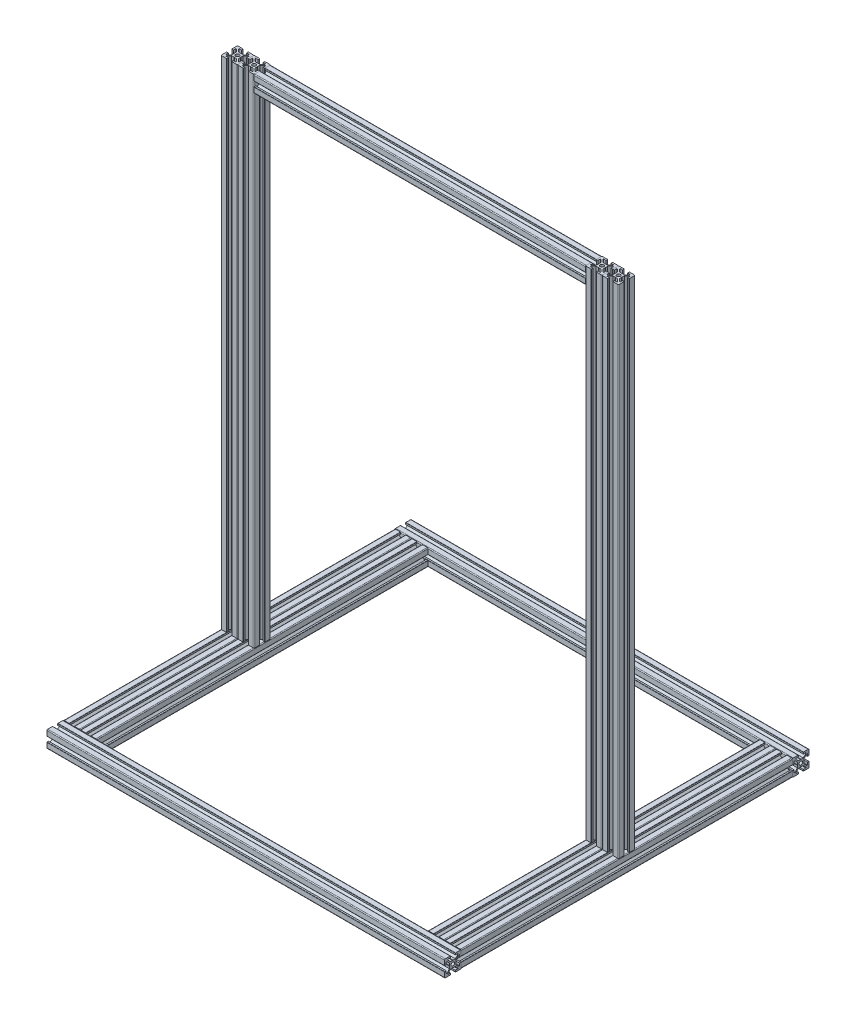
from build123d import *

# Parameters (mm, degrees)
SKETCH13_R                  = 2.1
SFF_204T_SFF_204T_2_DEPTH   = 480
SKETCH13_ON_SEGMENT_2_R     = 2.1
SFF_204T_SFF_204T_2_2_DEPTH = 480
SKETCH14_R                  = 2.1
SFF_204T_SFF_204T_3_DEPTH   = 400
SKETCH14_ON_SEGMENT_2_R     = 2.1
SFF_204T_SFF_204T_3_2_DEPTH = 400
SKETCH14_ON_SEGMENT_3_R     = 2.1
SFF_204T_SFF_204T_3_3_DEPTH = 400
SKETCH14_ON_SEGMENT_4_R     = 2.1
SFF_204T_SFF_204T_3_4_DEPTH = 400
SKETCH16_R                  = 2.1
SFF_204T_SFF_204T_5_DEPTH   = 600
SKETCH16_ON_SEGMENT_2_R     = 2.1
SFF_204T_SFF_204T_5_2_DEPTH = 600
SKETCH16_ON_SEGMENT_3_R     = 2.1
SFF_204T_SFF_204T_5_3_DEPTH = 600
SKETCH16_ON_SEGMENT_4_R     = 2.1
SFF_204T_SFF_204T_5_4_DEPTH = 600
SKETCH17_R                  = 2.1
SFF_204T_SFF_204T_6_DEPTH   = 400


with BuildPart() as part:
    # Sketch13 → Sff-204t SFF-204T(2) (new body)
    with BuildSketch(Plane(origin=(0, 0, 0), x_dir=(0, 0, -1), z_dir=(1, 0, 0))):
        with BuildLine():
            Line((0, 3.7), (0.3, 4))
            Line((0.3, 4), (2.94, 4))
            Line((2.94, 4), (6, 7.06))
            Line((6, 7.06), (6, 8))
            Line((6, 8), (3, 8))
            Line((3, 8), (3, 9.7))
            ThreePointArc((3, 9.7), (3.087867966, 9.912132034), (3.3, 10))
            Line((3.3, 10), (9, 10))
            ThreePointArc((9, 10), (9.707106781, 9.707106781), (10, 9))
            Line((10, 9), (10, 3.3))
            ThreePointArc((10, 3.3), (9.912132034, 3.087867966), (9.7, 3))
            Line((9.7, 3), (8, 3))
            Line((8, 3), (8, 6))
            Line((8, 6), (7.06, 6))
            Line((7.06, 6), (4, 2.94))
            Line((4, 2.94), (4, 0.3))
            Line((4, 0.3), (3.7, 0))
            Line((3.7, 0), (4, -0.3))
            Line((4, -0.3), (4, -2.94))
            Line((4, -2.94), (7.06, -6))
            Line((7.06, -6), (8, -6))
            Line((8, -6), (8, -3))
            Line((8, -3), (9.7, -3))
            ThreePointArc((9.7, -3), (9.912132034, -3.087867966), (10, -3.3))
            Line((10, -3.3), (10, -9))
            ThreePointArc((10, -9), (9.707106781, -9.707106781), (9, -10))
            Line((9, -10), (3.3, -10))
            ThreePointArc((3.3, -10), (3.087867966, -9.912132034), (3, -9.7))
            Line((3, -9.7), (3, -8))
            Line((3, -8), (6, -8))
            Line((6, -8), (6, -7.06))
            Line((6, -7.06), (2.94, -4))
            Line((2.94, -4), (0.3, -4))
            Line((0.3, -4), (0, -3.7))
            Line((0, -3.7), (-0.3, -4))
            Line((-0.3, -4), (-2.94, -4))
            Line((-2.94, -4), (-6, -7.06))
            Line((-6, -7.06), (-6, -8))
            Line((-6, -8), (-3, -8))
            Line((-3, -8), (-3, -9.7))
            ThreePointArc((-3, -9.7), (-3.087867966, -9.912132034), (-3.3, -10))
            Line((-3.3, -10), (-9, -10))
            ThreePointArc((-9, -10), (-9.707106781, -9.707106781), (-10, -9))
            Line((-10, -9), (-10, -3.3))
            ThreePointArc((-10, -3.3), (-9.912132034, -3.087867966), (-9.7, -3))
            Line((-9.7, -3), (-8, -3))
            Line((-8, -3), (-8, -6))
            Line((-8, -6), (-7.06, -6))
            Line((-7.06, -6), (-4, -2.94))
            Line((-4, -2.94), (-4, -0.3))
            Line((-4, -0.3), (-3.7, 0))
            Line((-3.7, 0), (-4, 0.3))
            Line((-4, 0.3), (-4, 2.94))
            Line((-4, 2.94), (-7.06, 6))
            Line((-7.06, 6), (-8, 6))
            Line((-8, 6), (-8, 3))
            Line((-8, 3), (-9.7, 3))
            ThreePointArc((-9.7, 3), (-9.912132034, 3.087867966), (-10, 3.3))
            Line((-10, 3.3), (-10, 9))
            ThreePointArc((-10, 9), (-9.707106781, 9.707106781), (-9, 10))
            Line((-9, 10), (-3.3, 10))
            ThreePointArc((-3.3, 10), (-3.087867966, 9.912132034), (-3, 9.7))
            Line((-3, 9.7), (-3, 8))
            Line((-3, 8), (-6, 8))
            Line((-6, 8), (-6, 7.06))
            Line((-6, 7.06), (-2.94, 4))
            Line((-2.94, 4), (-0.3, 4))
            Line((-0.3, 4), (0, 3.7))
        make_face()
        Circle(SKETCH13_R, mode=Mode.SUBTRACT)
    extrude(amount=SFF_204T_SFF_204T_2_DEPTH)


with BuildPart() as body_2:
    # Sketch13 on segment 2 (carried to segment 2) → Sff-204t SFF-204T_2 2 (new body)
    with BuildSketch(Plane(origin=(0, 0, -420), x_dir=(0, 0, -1), z_dir=(1, 0, 0))):
        with BuildLine():
            Line((0, 3.7), (0.3, 4))
            Line((0.3, 4), (2.94, 4))
            Line((2.94, 4), (6, 7.06))
            Line((6, 7.06), (6, 8))
            Line((6, 8), (3, 8))
            Line((3, 8), (3, 9.7))
            ThreePointArc((3, 9.7), (3.087867966, 9.912132034), (3.3, 10))
            Line((3.3, 10), (9, 10))
            ThreePointArc((9, 10), (9.707106781, 9.707106781), (10, 9))
            Line((10, 9), (10, 3.3))
            ThreePointArc((10, 3.3), (9.912132034, 3.087867966), (9.7, 3))
            Line((9.7, 3), (8, 3))
            Line((8, 3), (8, 6))
            Line((8, 6), (7.06, 6))
            Line((7.06, 6), (4, 2.94))
            Line((4, 2.94), (4, 0.3))
            Line((4, 0.3), (3.7, 0))
            Line((3.7, 0), (4, -0.3))
            Line((4, -0.3), (4, -2.94))
            Line((4, -2.94), (7.06, -6))
            Line((7.06, -6), (8, -6))
            Line((8, -6), (8, -3))
            Line((8, -3), (9.7, -3))
            ThreePointArc((9.7, -3), (9.912132034, -3.087867966), (10, -3.3))
            Line((10, -3.3), (10, -9))
            ThreePointArc((10, -9), (9.707106781, -9.707106781), (9, -10))
            Line((9, -10), (3.3, -10))
            ThreePointArc((3.3, -10), (3.087867966, -9.912132034), (3, -9.7))
            Line((3, -9.7), (3, -8))
            Line((3, -8), (6, -8))
            Line((6, -8), (6, -7.06))
            Line((6, -7.06), (2.94, -4))
            Line((2.94, -4), (0.3, -4))
            Line((0.3, -4), (0, -3.7))
            Line((0, -3.7), (-0.3, -4))
            Line((-0.3, -4), (-2.94, -4))
            Line((-2.94, -4), (-6, -7.06))
            Line((-6, -7.06), (-6, -8))
            Line((-6, -8), (-3, -8))
            Line((-3, -8), (-3, -9.7))
            ThreePointArc((-3, -9.7), (-3.087867966, -9.912132034), (-3.3, -10))
            Line((-3.3, -10), (-9, -10))
            ThreePointArc((-9, -10), (-9.707106781, -9.707106781), (-10, -9))
            Line((-10, -9), (-10, -3.3))
            ThreePointArc((-10, -3.3), (-9.912132034, -3.087867966), (-9.7, -3))
            Line((-9.7, -3), (-8, -3))
            Line((-8, -3), (-8, -6))
            Line((-8, -6), (-7.06, -6))
            Line((-7.06, -6), (-4, -2.94))
            Line((-4, -2.94), (-4, -0.3))
            Line((-4, -0.3), (-3.7, 0))
            Line((-3.7, 0), (-4, 0.3))
            Line((-4, 0.3), (-4, 2.94))
            Line((-4, 2.94), (-7.06, 6))
            Line((-7.06, 6), (-8, 6))
            Line((-8, 6), (-8, 3))
            Line((-8, 3), (-9.7, 3))
            ThreePointArc((-9.7, 3), (-9.912132034, 3.087867966), (-10, 3.3))
            Line((-10, 3.3), (-10, 9))
            ThreePointArc((-10, 9), (-9.707106781, 9.707106781), (-9, 10))
            Line((-9, 10), (-3.3, 10))
            ThreePointArc((-3.3, 10), (-3.087867966, 9.912132034), (-3, 9.7))
            Line((-3, 9.7), (-3, 8))
            Line((-3, 8), (-6, 8))
            Line((-6, 8), (-6, 7.06))
            Line((-6, 7.06), (-2.94, 4))
            Line((-2.94, 4), (-0.3, 4))
            Line((-0.3, 4), (0, 3.7))
        make_face()
        Circle(SKETCH13_ON_SEGMENT_2_R, mode=Mode.SUBTRACT)
    extrude(amount=SFF_204T_SFF_204T_2_2_DEPTH)


with BuildPart() as body_3:
    # Sketch14 → Sff-204t SFF-204T(3) (new body)
    with BuildSketch(Plane(origin=(10, 0, -410), x_dir=(1, 0, 0), z_dir=(0, 0, 1))):
        with BuildLine():
            Line((0, 3.7), (0.3, 4))
            Line((0.3, 4), (2.94, 4))
            Line((2.94, 4), (6, 7.06))
            Line((6, 7.06), (6, 8))
            Line((6, 8), (3, 8))
            Line((3, 8), (3, 9.7))
            ThreePointArc((3, 9.7), (3.087867966, 9.912132034), (3.3, 10))
            Line((3.3, 10), (9, 10))
            ThreePointArc((9, 10), (9.707106781, 9.707106781), (10, 9))
            Line((10, 9), (10, 3.3))
            ThreePointArc((10, 3.3), (9.912132034, 3.087867966), (9.7, 3))
            Line((9.7, 3), (8, 3))
            Line((8, 3), (8, 6))
            Line((8, 6), (7.06, 6))
            Line((7.06, 6), (4, 2.94))
            Line((4, 2.94), (4, 0.3))
            Line((4, 0.3), (3.7, 0))
            Line((3.7, 0), (4, -0.3))
            Line((4, -0.3), (4, -2.94))
            Line((4, -2.94), (7.06, -6))
            Line((7.06, -6), (8, -6))
            Line((8, -6), (8, -3))
            Line((8, -3), (9.7, -3))
            ThreePointArc((9.7, -3), (9.912132034, -3.087867966), (10, -3.3))
            Line((10, -3.3), (10, -9))
            ThreePointArc((10, -9), (9.707106781, -9.707106781), (9, -10))
            Line((9, -10), (3.3, -10))
            ThreePointArc((3.3, -10), (3.087867966, -9.912132034), (3, -9.7))
            Line((3, -9.7), (3, -8))
            Line((3, -8), (6, -8))
            Line((6, -8), (6, -7.06))
            Line((6, -7.06), (2.94, -4))
            Line((2.94, -4), (0.3, -4))
            Line((0.3, -4), (0, -3.7))
            Line((0, -3.7), (-0.3, -4))
            Line((-0.3, -4), (-2.94, -4))
            Line((-2.94, -4), (-6, -7.06))
            Line((-6, -7.06), (-6, -8))
            Line((-6, -8), (-3, -8))
            Line((-3, -8), (-3, -9.7))
            ThreePointArc((-3, -9.7), (-3.087867966, -9.912132034), (-3.3, -10))
            Line((-3.3, -10), (-9, -10))
            ThreePointArc((-9, -10), (-9.707106781, -9.707106781), (-10, -9))
            Line((-10, -9), (-10, -3.3))
            ThreePointArc((-10, -3.3), (-9.912132034, -3.087867966), (-9.7, -3))
            Line((-9.7, -3), (-8, -3))
            Line((-8, -3), (-8, -6))
            Line((-8, -6), (-7.06, -6))
            Line((-7.06, -6), (-4, -2.94))
            Line((-4, -2.94), (-4, -0.3))
            Line((-4, -0.3), (-3.7, 0))
            Line((-3.7, 0), (-4, 0.3))
            Line((-4, 0.3), (-4, 2.94))
            Line((-4, 2.94), (-7.06, 6))
            Line((-7.06, 6), (-8, 6))
            Line((-8, 6), (-8, 3))
            Line((-8, 3), (-9.7, 3))
            ThreePointArc((-9.7, 3), (-9.912132034, 3.087867966), (-10, 3.3))
            Line((-10, 3.3), (-10, 9))
            ThreePointArc((-10, 9), (-9.707106781, 9.707106781), (-9, 10))
            Line((-9, 10), (-3.3, 10))
            ThreePointArc((-3.3, 10), (-3.087867966, 9.912132034), (-3, 9.7))
            Line((-3, 9.7), (-3, 8))
            Line((-3, 8), (-6, 8))
            Line((-6, 8), (-6, 7.06))
            Line((-6, 7.06), (-2.94, 4))
            Line((-2.94, 4), (-0.3, 4))
            Line((-0.3, 4), (0, 3.7))
        make_face()
        Circle(SKETCH14_R, mode=Mode.SUBTRACT)
    extrude(amount=SFF_204T_SFF_204T_3_DEPTH)


with BuildPart() as body_4:
    # Sketch14 on segment 2 (carried to segment 2) → Sff-204t SFF-204T_3 2 (new body)
    with BuildSketch(Plane(origin=(470, 0, -410), x_dir=(1, 0, 0), z_dir=(0, 0, 1))):
        with BuildLine():
            Line((0, 3.7), (0.3, 4))
            Line((0.3, 4), (2.94, 4))
            Line((2.94, 4), (6, 7.06))
            Line((6, 7.06), (6, 8))
            Line((6, 8), (3, 8))
            Line((3, 8), (3, 9.7))
            ThreePointArc((3, 9.7), (3.087867966, 9.912132034), (3.3, 10))
            Line((3.3, 10), (9, 10))
            ThreePointArc((9, 10), (9.707106781, 9.707106781), (10, 9))
            Line((10, 9), (10, 3.3))
            ThreePointArc((10, 3.3), (9.912132034, 3.087867966), (9.7, 3))
            Line((9.7, 3), (8, 3))
            Line((8, 3), (8, 6))
            Line((8, 6), (7.06, 6))
            Line((7.06, 6), (4, 2.94))
            Line((4, 2.94), (4, 0.3))
            Line((4, 0.3), (3.7, 0))
            Line((3.7, 0), (4, -0.3))
            Line((4, -0.3), (4, -2.94))
            Line((4, -2.94), (7.06, -6))
            Line((7.06, -6), (8, -6))
            Line((8, -6), (8, -3))
            Line((8, -3), (9.7, -3))
            ThreePointArc((9.7, -3), (9.912132034, -3.087867966), (10, -3.3))
            Line((10, -3.3), (10, -9))
            ThreePointArc((10, -9), (9.707106781, -9.707106781), (9, -10))
            Line((9, -10), (3.3, -10))
            ThreePointArc((3.3, -10), (3.087867966, -9.912132034), (3, -9.7))
            Line((3, -9.7), (3, -8))
            Line((3, -8), (6, -8))
            Line((6, -8), (6, -7.06))
            Line((6, -7.06), (2.94, -4))
            Line((2.94, -4), (0.3, -4))
            Line((0.3, -4), (0, -3.7))
            Line((0, -3.7), (-0.3, -4))
            Line((-0.3, -4), (-2.94, -4))
            Line((-2.94, -4), (-6, -7.06))
            Line((-6, -7.06), (-6, -8))
            Line((-6, -8), (-3, -8))
            Line((-3, -8), (-3, -9.7))
            ThreePointArc((-3, -9.7), (-3.087867966, -9.912132034), (-3.3, -10))
            Line((-3.3, -10), (-9, -10))
            ThreePointArc((-9, -10), (-9.707106781, -9.707106781), (-10, -9))
            Line((-10, -9), (-10, -3.3))
            ThreePointArc((-10, -3.3), (-9.912132034, -3.087867966), (-9.7, -3))
            Line((-9.7, -3), (-8, -3))
            Line((-8, -3), (-8, -6))
            Line((-8, -6), (-7.06, -6))
            Line((-7.06, -6), (-4, -2.94))
            Line((-4, -2.94), (-4, -0.3))
            Line((-4, -0.3), (-3.7, 0))
            Line((-3.7, 0), (-4, 0.3))
            Line((-4, 0.3), (-4, 2.94))
            Line((-4, 2.94), (-7.06, 6))
            Line((-7.06, 6), (-8, 6))
            Line((-8, 6), (-8, 3))
            Line((-8, 3), (-9.7, 3))
            ThreePointArc((-9.7, 3), (-9.912132034, 3.087867966), (-10, 3.3))
            Line((-10, 3.3), (-10, 9))
            ThreePointArc((-10, 9), (-9.707106781, 9.707106781), (-9, 10))
            Line((-9, 10), (-3.3, 10))
            ThreePointArc((-3.3, 10), (-3.087867966, 9.912132034), (-3, 9.7))
            Line((-3, 9.7), (-3, 8))
            Line((-3, 8), (-6, 8))
            Line((-6, 8), (-6, 7.06))
            Line((-6, 7.06), (-2.94, 4))
            Line((-2.94, 4), (-0.3, 4))
            Line((-0.3, 4), (0, 3.7))
        make_face()
        Circle(SKETCH14_ON_SEGMENT_2_R, mode=Mode.SUBTRACT)
    extrude(amount=SFF_204T_SFF_204T_3_2_DEPTH)


with BuildPart() as body_5:
    # Sketch14 on segment 3 (carried to segment 3) → Sff-204t SFF-204T_3 3 (new body)
    with BuildSketch(Plane(origin=(30, 0, -410), x_dir=(1, 0, 0), z_dir=(0, 0, 1))):
        with BuildLine():
            Line((0, 3.7), (0.3, 4))
            Line((0.3, 4), (2.94, 4))
            Line((2.94, 4), (6, 7.06))
            Line((6, 7.06), (6, 8))
            Line((6, 8), (3, 8))
            Line((3, 8), (3, 9.7))
            ThreePointArc((3, 9.7), (3.087867966, 9.912132034), (3.3, 10))
            Line((3.3, 10), (9, 10))
            ThreePointArc((9, 10), (9.707106781, 9.707106781), (10, 9))
            Line((10, 9), (10, 3.3))
            ThreePointArc((10, 3.3), (9.912132034, 3.087867966), (9.7, 3))
            Line((9.7, 3), (8, 3))
            Line((8, 3), (8, 6))
            Line((8, 6), (7.06, 6))
            Line((7.06, 6), (4, 2.94))
            Line((4, 2.94), (4, 0.3))
            Line((4, 0.3), (3.7, 0))
            Line((3.7, 0), (4, -0.3))
            Line((4, -0.3), (4, -2.94))
            Line((4, -2.94), (7.06, -6))
            Line((7.06, -6), (8, -6))
            Line((8, -6), (8, -3))
            Line((8, -3), (9.7, -3))
            ThreePointArc((9.7, -3), (9.912132034, -3.087867966), (10, -3.3))
            Line((10, -3.3), (10, -9))
            ThreePointArc((10, -9), (9.707106781, -9.707106781), (9, -10))
            Line((9, -10), (3.3, -10))
            ThreePointArc((3.3, -10), (3.087867966, -9.912132034), (3, -9.7))
            Line((3, -9.7), (3, -8))
            Line((3, -8), (6, -8))
            Line((6, -8), (6, -7.06))
            Line((6, -7.06), (2.94, -4))
            Line((2.94, -4), (0.3, -4))
            Line((0.3, -4), (0, -3.7))
            Line((0, -3.7), (-0.3, -4))
            Line((-0.3, -4), (-2.94, -4))
            Line((-2.94, -4), (-6, -7.06))
            Line((-6, -7.06), (-6, -8))
            Line((-6, -8), (-3, -8))
            Line((-3, -8), (-3, -9.7))
            ThreePointArc((-3, -9.7), (-3.087867966, -9.912132034), (-3.3, -10))
            Line((-3.3, -10), (-9, -10))
            ThreePointArc((-9, -10), (-9.707106781, -9.707106781), (-10, -9))
            Line((-10, -9), (-10, -3.3))
            ThreePointArc((-10, -3.3), (-9.912132034, -3.087867966), (-9.7, -3))
            Line((-9.7, -3), (-8, -3))
            Line((-8, -3), (-8, -6))
            Line((-8, -6), (-7.06, -6))
            Line((-7.06, -6), (-4, -2.94))
            Line((-4, -2.94), (-4, -0.3))
            Line((-4, -0.3), (-3.7, 0))
            Line((-3.7, 0), (-4, 0.3))
            Line((-4, 0.3), (-4, 2.94))
            Line((-4, 2.94), (-7.06, 6))
            Line((-7.06, 6), (-8, 6))
            Line((-8, 6), (-8, 3))
            Line((-8, 3), (-9.7, 3))
            ThreePointArc((-9.7, 3), (-9.912132034, 3.087867966), (-10, 3.3))
            Line((-10, 3.3), (-10, 9))
            ThreePointArc((-10, 9), (-9.707106781, 9.707106781), (-9, 10))
            Line((-9, 10), (-3.3, 10))
            ThreePointArc((-3.3, 10), (-3.087867966, 9.912132034), (-3, 9.7))
            Line((-3, 9.7), (-3, 8))
            Line((-3, 8), (-6, 8))
            Line((-6, 8), (-6, 7.06))
            Line((-6, 7.06), (-2.94, 4))
            Line((-2.94, 4), (-0.3, 4))
            Line((-0.3, 4), (0, 3.7))
        make_face()
        Circle(SKETCH14_ON_SEGMENT_3_R, mode=Mode.SUBTRACT)
    extrude(amount=SFF_204T_SFF_204T_3_3_DEPTH)


with BuildPart() as body_6:
    # Sketch14 on segment 4 (carried to segment 4) → Sff-204t SFF-204T_3 4 (new body)
    with BuildSketch(Plane(origin=(450, 0, -410), x_dir=(1, 0, 0), z_dir=(0, 0, 1))):
        with BuildLine():
            Line((0, 3.7), (0.3, 4))
            Line((0.3, 4), (2.94, 4))
            Line((2.94, 4), (6, 7.06))
            Line((6, 7.06), (6, 8))
            Line((6, 8), (3, 8))
            Line((3, 8), (3, 9.7))
            ThreePointArc((3, 9.7), (3.087867966, 9.912132034), (3.3, 10))
            Line((3.3, 10), (9, 10))
            ThreePointArc((9, 10), (9.707106781, 9.707106781), (10, 9))
            Line((10, 9), (10, 3.3))
            ThreePointArc((10, 3.3), (9.912132034, 3.087867966), (9.7, 3))
            Line((9.7, 3), (8, 3))
            Line((8, 3), (8, 6))
            Line((8, 6), (7.06, 6))
            Line((7.06, 6), (4, 2.94))
            Line((4, 2.94), (4, 0.3))
            Line((4, 0.3), (3.7, 0))
            Line((3.7, 0), (4, -0.3))
            Line((4, -0.3), (4, -2.94))
            Line((4, -2.94), (7.06, -6))
            Line((7.06, -6), (8, -6))
            Line((8, -6), (8, -3))
            Line((8, -3), (9.7, -3))
            ThreePointArc((9.7, -3), (9.912132034, -3.087867966), (10, -3.3))
            Line((10, -3.3), (10, -9))
            ThreePointArc((10, -9), (9.707106781, -9.707106781), (9, -10))
            Line((9, -10), (3.3, -10))
            ThreePointArc((3.3, -10), (3.087867966, -9.912132034), (3, -9.7))
            Line((3, -9.7), (3, -8))
            Line((3, -8), (6, -8))
            Line((6, -8), (6, -7.06))
            Line((6, -7.06), (2.94, -4))
            Line((2.94, -4), (0.3, -4))
            Line((0.3, -4), (0, -3.7))
            Line((0, -3.7), (-0.3, -4))
            Line((-0.3, -4), (-2.94, -4))
            Line((-2.94, -4), (-6, -7.06))
            Line((-6, -7.06), (-6, -8))
            Line((-6, -8), (-3, -8))
            Line((-3, -8), (-3, -9.7))
            ThreePointArc((-3, -9.7), (-3.087867966, -9.912132034), (-3.3, -10))
            Line((-3.3, -10), (-9, -10))
            ThreePointArc((-9, -10), (-9.707106781, -9.707106781), (-10, -9))
            Line((-10, -9), (-10, -3.3))
            ThreePointArc((-10, -3.3), (-9.912132034, -3.087867966), (-9.7, -3))
            Line((-9.7, -3), (-8, -3))
            Line((-8, -3), (-8, -6))
            Line((-8, -6), (-7.06, -6))
            Line((-7.06, -6), (-4, -2.94))
            Line((-4, -2.94), (-4, -0.3))
            Line((-4, -0.3), (-3.7, 0))
            Line((-3.7, 0), (-4, 0.3))
            Line((-4, 0.3), (-4, 2.94))
            Line((-4, 2.94), (-7.06, 6))
            Line((-7.06, 6), (-8, 6))
            Line((-8, 6), (-8, 3))
            Line((-8, 3), (-9.7, 3))
            ThreePointArc((-9.7, 3), (-9.912132034, 3.087867966), (-10, 3.3))
            Line((-10, 3.3), (-10, 9))
            ThreePointArc((-10, 9), (-9.707106781, 9.707106781), (-9, 10))
            Line((-9, 10), (-3.3, 10))
            ThreePointArc((-3.3, 10), (-3.087867966, 9.912132034), (-3, 9.7))
            Line((-3, 9.7), (-3, 8))
            Line((-3, 8), (-6, 8))
            Line((-6, 8), (-6, 7.06))
            Line((-6, 7.06), (-2.94, 4))
            Line((-2.94, 4), (-0.3, 4))
            Line((-0.3, 4), (0, 3.7))
        make_face()
        Circle(SKETCH14_ON_SEGMENT_4_R, mode=Mode.SUBTRACT)
    extrude(amount=SFF_204T_SFF_204T_3_4_DEPTH)


with BuildPart() as body_7:
    # Sketch16 → Sff-204t SFF-204T(5) (new body)
    with BuildSketch(Plane(origin=(10, 10, -210), x_dir=(-1, 0, 0), z_dir=(0, 1, 0))):
        with BuildLine():
            Line((0, 3.7), (0.3, 4))
            Line((0.3, 4), (2.94, 4))
            Line((2.94, 4), (6, 7.06))
            Line((6, 7.06), (6, 8))
            Line((6, 8), (3, 8))
            Line((3, 8), (3, 9.7))
            ThreePointArc((3, 9.7), (3.087867966, 9.912132034), (3.3, 10))
            Line((3.3, 10), (9, 10))
            ThreePointArc((9, 10), (9.707106781, 9.707106781), (10, 9))
            Line((10, 9), (10, 3.3))
            ThreePointArc((10, 3.3), (9.912132034, 3.087867966), (9.7, 3))
            Line((9.7, 3), (8, 3))
            Line((8, 3), (8, 6))
            Line((8, 6), (7.06, 6))
            Line((7.06, 6), (4, 2.94))
            Line((4, 2.94), (4, 0.3))
            Line((4, 0.3), (3.7, 0))
            Line((3.7, 0), (4, -0.3))
            Line((4, -0.3), (4, -2.94))
            Line((4, -2.94), (7.06, -6))
            Line((7.06, -6), (8, -6))
            Line((8, -6), (8, -3))
            Line((8, -3), (9.7, -3))
            ThreePointArc((9.7, -3), (9.912132034, -3.087867966), (10, -3.3))
            Line((10, -3.3), (10, -9))
            ThreePointArc((10, -9), (9.707106781, -9.707106781), (9, -10))
            Line((9, -10), (3.3, -10))
            ThreePointArc((3.3, -10), (3.087867966, -9.912132034), (3, -9.7))
            Line((3, -9.7), (3, -8))
            Line((3, -8), (6, -8))
            Line((6, -8), (6, -7.06))
            Line((6, -7.06), (2.94, -4))
            Line((2.94, -4), (0.3, -4))
            Line((0.3, -4), (0, -3.7))
            Line((0, -3.7), (-0.3, -4))
            Line((-0.3, -4), (-2.94, -4))
            Line((-2.94, -4), (-6, -7.06))
            Line((-6, -7.06), (-6, -8))
            Line((-6, -8), (-3, -8))
            Line((-3, -8), (-3, -9.7))
            ThreePointArc((-3, -9.7), (-3.087867966, -9.912132034), (-3.3, -10))
            Line((-3.3, -10), (-9, -10))
            ThreePointArc((-9, -10), (-9.707106781, -9.707106781), (-10, -9))
            Line((-10, -9), (-10, -3.3))
            ThreePointArc((-10, -3.3), (-9.912132034, -3.087867966), (-9.7, -3))
            Line((-9.7, -3), (-8, -3))
            Line((-8, -3), (-8, -6))
            Line((-8, -6), (-7.06, -6))
            Line((-7.06, -6), (-4, -2.94))
            Line((-4, -2.94), (-4, -0.3))
            Line((-4, -0.3), (-3.7, 0))
            Line((-3.7, 0), (-4, 0.3))
            Line((-4, 0.3), (-4, 2.94))
            Line((-4, 2.94), (-7.06, 6))
            Line((-7.06, 6), (-8, 6))
            Line((-8, 6), (-8, 3))
            Line((-8, 3), (-9.7, 3))
            ThreePointArc((-9.7, 3), (-9.912132034, 3.087867966), (-10, 3.3))
            Line((-10, 3.3), (-10, 9))
            ThreePointArc((-10, 9), (-9.707106781, 9.707106781), (-9, 10))
            Line((-9, 10), (-3.3, 10))
            ThreePointArc((-3.3, 10), (-3.087867966, 9.912132034), (-3, 9.7))
            Line((-3, 9.7), (-3, 8))
            Line((-3, 8), (-6, 8))
            Line((-6, 8), (-6, 7.06))
            Line((-6, 7.06), (-2.94, 4))
            Line((-2.94, 4), (-0.3, 4))
            Line((-0.3, 4), (0, 3.7))
        make_face()
        Circle(SKETCH16_R, mode=Mode.SUBTRACT)
    extrude(amount=SFF_204T_SFF_204T_5_DEPTH)


with BuildPart() as body_8:
    # Sketch16 on segment 2 (carried to segment 2) → Sff-204t SFF-204T_5 2 (new body)
    with BuildSketch(Plane(origin=(30, 10, -210), x_dir=(-1, 0, 0), z_dir=(0, 1, 0))):
        with BuildLine():
            Line((0, 3.7), (0.3, 4))
            Line((0.3, 4), (2.94, 4))
            Line((2.94, 4), (6, 7.06))
            Line((6, 7.06), (6, 8))
            Line((6, 8), (3, 8))
            Line((3, 8), (3, 9.7))
            ThreePointArc((3, 9.7), (3.087867966, 9.912132034), (3.3, 10))
            Line((3.3, 10), (9, 10))
            ThreePointArc((9, 10), (9.707106781, 9.707106781), (10, 9))
            Line((10, 9), (10, 3.3))
            ThreePointArc((10, 3.3), (9.912132034, 3.087867966), (9.7, 3))
            Line((9.7, 3), (8, 3))
            Line((8, 3), (8, 6))
            Line((8, 6), (7.06, 6))
            Line((7.06, 6), (4, 2.94))
            Line((4, 2.94), (4, 0.3))
            Line((4, 0.3), (3.7, 0))
            Line((3.7, 0), (4, -0.3))
            Line((4, -0.3), (4, -2.94))
            Line((4, -2.94), (7.06, -6))
            Line((7.06, -6), (8, -6))
            Line((8, -6), (8, -3))
            Line((8, -3), (9.7, -3))
            ThreePointArc((9.7, -3), (9.912132034, -3.087867966), (10, -3.3))
            Line((10, -3.3), (10, -9))
            ThreePointArc((10, -9), (9.707106781, -9.707106781), (9, -10))
            Line((9, -10), (3.3, -10))
            ThreePointArc((3.3, -10), (3.087867966, -9.912132034), (3, -9.7))
            Line((3, -9.7), (3, -8))
            Line((3, -8), (6, -8))
            Line((6, -8), (6, -7.06))
            Line((6, -7.06), (2.94, -4))
            Line((2.94, -4), (0.3, -4))
            Line((0.3, -4), (0, -3.7))
            Line((0, -3.7), (-0.3, -4))
            Line((-0.3, -4), (-2.94, -4))
            Line((-2.94, -4), (-6, -7.06))
            Line((-6, -7.06), (-6, -8))
            Line((-6, -8), (-3, -8))
            Line((-3, -8), (-3, -9.7))
            ThreePointArc((-3, -9.7), (-3.087867966, -9.912132034), (-3.3, -10))
            Line((-3.3, -10), (-9, -10))
            ThreePointArc((-9, -10), (-9.707106781, -9.707106781), (-10, -9))
            Line((-10, -9), (-10, -3.3))
            ThreePointArc((-10, -3.3), (-9.912132034, -3.087867966), (-9.7, -3))
            Line((-9.7, -3), (-8, -3))
            Line((-8, -3), (-8, -6))
            Line((-8, -6), (-7.06, -6))
            Line((-7.06, -6), (-4, -2.94))
            Line((-4, -2.94), (-4, -0.3))
            Line((-4, -0.3), (-3.7, 0))
            Line((-3.7, 0), (-4, 0.3))
            Line((-4, 0.3), (-4, 2.94))
            Line((-4, 2.94), (-7.06, 6))
            Line((-7.06, 6), (-8, 6))
            Line((-8, 6), (-8, 3))
            Line((-8, 3), (-9.7, 3))
            ThreePointArc((-9.7, 3), (-9.912132034, 3.087867966), (-10, 3.3))
            Line((-10, 3.3), (-10, 9))
            ThreePointArc((-10, 9), (-9.707106781, 9.707106781), (-9, 10))
            Line((-9, 10), (-3.3, 10))
            ThreePointArc((-3.3, 10), (-3.087867966, 9.912132034), (-3, 9.7))
            Line((-3, 9.7), (-3, 8))
            Line((-3, 8), (-6, 8))
            Line((-6, 8), (-6, 7.06))
            Line((-6, 7.06), (-2.94, 4))
            Line((-2.94, 4), (-0.3, 4))
            Line((-0.3, 4), (0, 3.7))
        make_face()
        Circle(SKETCH16_ON_SEGMENT_2_R, mode=Mode.SUBTRACT)
    extrude(amount=SFF_204T_SFF_204T_5_2_DEPTH)


with BuildPart() as body_9:
    # Sketch16 on segment 3 (carried to segment 3) → Sff-204t SFF-204T_5 3 (new body)
    with BuildSketch(Plane(origin=(450, 10, -210), x_dir=(-1, 0, 0), z_dir=(0, 1, 0))):
        with BuildLine():
            Line((0, 3.7), (0.3, 4))
            Line((0.3, 4), (2.94, 4))
            Line((2.94, 4), (6, 7.06))
            Line((6, 7.06), (6, 8))
            Line((6, 8), (3, 8))
            Line((3, 8), (3, 9.7))
            ThreePointArc((3, 9.7), (3.087867966, 9.912132034), (3.3, 10))
            Line((3.3, 10), (9, 10))
            ThreePointArc((9, 10), (9.707106781, 9.707106781), (10, 9))
            Line((10, 9), (10, 3.3))
            ThreePointArc((10, 3.3), (9.912132034, 3.087867966), (9.7, 3))
            Line((9.7, 3), (8, 3))
            Line((8, 3), (8, 6))
            Line((8, 6), (7.06, 6))
            Line((7.06, 6), (4, 2.94))
            Line((4, 2.94), (4, 0.3))
            Line((4, 0.3), (3.7, 0))
            Line((3.7, 0), (4, -0.3))
            Line((4, -0.3), (4, -2.94))
            Line((4, -2.94), (7.06, -6))
            Line((7.06, -6), (8, -6))
            Line((8, -6), (8, -3))
            Line((8, -3), (9.7, -3))
            ThreePointArc((9.7, -3), (9.912132034, -3.087867966), (10, -3.3))
            Line((10, -3.3), (10, -9))
            ThreePointArc((10, -9), (9.707106781, -9.707106781), (9, -10))
            Line((9, -10), (3.3, -10))
            ThreePointArc((3.3, -10), (3.087867966, -9.912132034), (3, -9.7))
            Line((3, -9.7), (3, -8))
            Line((3, -8), (6, -8))
            Line((6, -8), (6, -7.06))
            Line((6, -7.06), (2.94, -4))
            Line((2.94, -4), (0.3, -4))
            Line((0.3, -4), (0, -3.7))
            Line((0, -3.7), (-0.3, -4))
            Line((-0.3, -4), (-2.94, -4))
            Line((-2.94, -4), (-6, -7.06))
            Line((-6, -7.06), (-6, -8))
            Line((-6, -8), (-3, -8))
            Line((-3, -8), (-3, -9.7))
            ThreePointArc((-3, -9.7), (-3.087867966, -9.912132034), (-3.3, -10))
            Line((-3.3, -10), (-9, -10))
            ThreePointArc((-9, -10), (-9.707106781, -9.707106781), (-10, -9))
            Line((-10, -9), (-10, -3.3))
            ThreePointArc((-10, -3.3), (-9.912132034, -3.087867966), (-9.7, -3))
            Line((-9.7, -3), (-8, -3))
            Line((-8, -3), (-8, -6))
            Line((-8, -6), (-7.06, -6))
            Line((-7.06, -6), (-4, -2.94))
            Line((-4, -2.94), (-4, -0.3))
            Line((-4, -0.3), (-3.7, 0))
            Line((-3.7, 0), (-4, 0.3))
            Line((-4, 0.3), (-4, 2.94))
            Line((-4, 2.94), (-7.06, 6))
            Line((-7.06, 6), (-8, 6))
            Line((-8, 6), (-8, 3))
            Line((-8, 3), (-9.7, 3))
            ThreePointArc((-9.7, 3), (-9.912132034, 3.087867966), (-10, 3.3))
            Line((-10, 3.3), (-10, 9))
            ThreePointArc((-10, 9), (-9.707106781, 9.707106781), (-9, 10))
            Line((-9, 10), (-3.3, 10))
            ThreePointArc((-3.3, 10), (-3.087867966, 9.912132034), (-3, 9.7))
            Line((-3, 9.7), (-3, 8))
            Line((-3, 8), (-6, 8))
            Line((-6, 8), (-6, 7.06))
            Line((-6, 7.06), (-2.94, 4))
            Line((-2.94, 4), (-0.3, 4))
            Line((-0.3, 4), (0, 3.7))
        make_face()
        Circle(SKETCH16_ON_SEGMENT_3_R, mode=Mode.SUBTRACT)
    extrude(amount=SFF_204T_SFF_204T_5_3_DEPTH)


with BuildPart() as body_10:
    # Sketch16 on segment 4 (carried to segment 4) → Sff-204t SFF-204T_5 4 (new body)
    with BuildSketch(Plane(origin=(470, 10, -210), x_dir=(-1, 0, 0), z_dir=(0, 1, 0))):
        with BuildLine():
            Line((0, 3.7), (0.3, 4))
            Line((0.3, 4), (2.94, 4))
            Line((2.94, 4), (6, 7.06))
            Line((6, 7.06), (6, 8))
            Line((6, 8), (3, 8))
            Line((3, 8), (3, 9.7))
            ThreePointArc((3, 9.7), (3.087867966, 9.912132034), (3.3, 10))
            Line((3.3, 10), (9, 10))
            ThreePointArc((9, 10), (9.707106781, 9.707106781), (10, 9))
            Line((10, 9), (10, 3.3))
            ThreePointArc((10, 3.3), (9.912132034, 3.087867966), (9.7, 3))
            Line((9.7, 3), (8, 3))
            Line((8, 3), (8, 6))
            Line((8, 6), (7.06, 6))
            Line((7.06, 6), (4, 2.94))
            Line((4, 2.94), (4, 0.3))
            Line((4, 0.3), (3.7, 0))
            Line((3.7, 0), (4, -0.3))
            Line((4, -0.3), (4, -2.94))
            Line((4, -2.94), (7.06, -6))
            Line((7.06, -6), (8, -6))
            Line((8, -6), (8, -3))
            Line((8, -3), (9.7, -3))
            ThreePointArc((9.7, -3), (9.912132034, -3.087867966), (10, -3.3))
            Line((10, -3.3), (10, -9))
            ThreePointArc((10, -9), (9.707106781, -9.707106781), (9, -10))
            Line((9, -10), (3.3, -10))
            ThreePointArc((3.3, -10), (3.087867966, -9.912132034), (3, -9.7))
            Line((3, -9.7), (3, -8))
            Line((3, -8), (6, -8))
            Line((6, -8), (6, -7.06))
            Line((6, -7.06), (2.94, -4))
            Line((2.94, -4), (0.3, -4))
            Line((0.3, -4), (0, -3.7))
            Line((0, -3.7), (-0.3, -4))
            Line((-0.3, -4), (-2.94, -4))
            Line((-2.94, -4), (-6, -7.06))
            Line((-6, -7.06), (-6, -8))
            Line((-6, -8), (-3, -8))
            Line((-3, -8), (-3, -9.7))
            ThreePointArc((-3, -9.7), (-3.087867966, -9.912132034), (-3.3, -10))
            Line((-3.3, -10), (-9, -10))
            ThreePointArc((-9, -10), (-9.707106781, -9.707106781), (-10, -9))
            Line((-10, -9), (-10, -3.3))
            ThreePointArc((-10, -3.3), (-9.912132034, -3.087867966), (-9.7, -3))
            Line((-9.7, -3), (-8, -3))
            Line((-8, -3), (-8, -6))
            Line((-8, -6), (-7.06, -6))
            Line((-7.06, -6), (-4, -2.94))
            Line((-4, -2.94), (-4, -0.3))
            Line((-4, -0.3), (-3.7, 0))
            Line((-3.7, 0), (-4, 0.3))
            Line((-4, 0.3), (-4, 2.94))
            Line((-4, 2.94), (-7.06, 6))
            Line((-7.06, 6), (-8, 6))
            Line((-8, 6), (-8, 3))
            Line((-8, 3), (-9.7, 3))
            ThreePointArc((-9.7, 3), (-9.912132034, 3.087867966), (-10, 3.3))
            Line((-10, 3.3), (-10, 9))
            ThreePointArc((-10, 9), (-9.707106781, 9.707106781), (-9, 10))
            Line((-9, 10), (-3.3, 10))
            ThreePointArc((-3.3, 10), (-3.087867966, 9.912132034), (-3, 9.7))
            Line((-3, 9.7), (-3, 8))
            Line((-3, 8), (-6, 8))
            Line((-6, 8), (-6, 7.06))
            Line((-6, 7.06), (-2.94, 4))
            Line((-2.94, 4), (-0.3, 4))
            Line((-0.3, 4), (0, 3.7))
        make_face()
        Circle(SKETCH16_ON_SEGMENT_4_R, mode=Mode.SUBTRACT)
    extrude(amount=SFF_204T_SFF_204T_5_4_DEPTH)


with BuildPart() as body_11:
    # Sketch17 → Sff-204t SFF-204T(6) (new body)
    with BuildSketch(Plane(origin=(40, 600, -210), x_dir=(0, 1, 0), z_dir=(1, 0, 0))):
        with BuildLine():
            Line((0, 3.7), (0.3, 4))
            Line((0.3, 4), (2.94, 4))
            Line((2.94, 4), (6, 7.06))
            Line((6, 7.06), (6, 8))
            Line((6, 8), (3, 8))
            Line((3, 8), (3, 9.7))
            ThreePointArc((3, 9.7), (3.087867966, 9.912132034), (3.3, 10))
            Line((3.3, 10), (9, 10))
            ThreePointArc((9, 10), (9.707106781, 9.707106781), (10, 9))
            Line((10, 9), (10, 3.3))
            ThreePointArc((10, 3.3), (9.912132034, 3.087867966), (9.7, 3))
            Line((9.7, 3), (8, 3))
            Line((8, 3), (8, 6))
            Line((8, 6), (7.06, 6))
            Line((7.06, 6), (4, 2.94))
            Line((4, 2.94), (4, 0.3))
            Line((4, 0.3), (3.7, 0))
            Line((3.7, 0), (4, -0.3))
            Line((4, -0.3), (4, -2.94))
            Line((4, -2.94), (7.06, -6))
            Line((7.06, -6), (8, -6))
            Line((8, -6), (8, -3))
            Line((8, -3), (9.7, -3))
            ThreePointArc((9.7, -3), (9.912132034, -3.087867966), (10, -3.3))
            Line((10, -3.3), (10, -9))
            ThreePointArc((10, -9), (9.707106781, -9.707106781), (9, -10))
            Line((9, -10), (3.3, -10))
            ThreePointArc((3.3, -10), (3.087867966, -9.912132034), (3, -9.7))
            Line((3, -9.7), (3, -8))
            Line((3, -8), (6, -8))
            Line((6, -8), (6, -7.06))
            Line((6, -7.06), (2.94, -4))
            Line((2.94, -4), (0.3, -4))
            Line((0.3, -4), (0, -3.7))
            Line((0, -3.7), (-0.3, -4))
            Line((-0.3, -4), (-2.94, -4))
            Line((-2.94, -4), (-6, -7.06))
            Line((-6, -7.06), (-6, -8))
            Line((-6, -8), (-3, -8))
            Line((-3, -8), (-3, -9.7))
            ThreePointArc((-3, -9.7), (-3.087867966, -9.912132034), (-3.3, -10))
            Line((-3.3, -10), (-9, -10))
            ThreePointArc((-9, -10), (-9.707106781, -9.707106781), (-10, -9))
            Line((-10, -9), (-10, -3.3))
            ThreePointArc((-10, -3.3), (-9.912132034, -3.087867966), (-9.7, -3))
            Line((-9.7, -3), (-8, -3))
            Line((-8, -3), (-8, -6))
            Line((-8, -6), (-7.06, -6))
            Line((-7.06, -6), (-4, -2.94))
            Line((-4, -2.94), (-4, -0.3))
            Line((-4, -0.3), (-3.7, 0))
            Line((-3.7, 0), (-4, 0.3))
            Line((-4, 0.3), (-4, 2.94))
            Line((-4, 2.94), (-7.06, 6))
            Line((-7.06, 6), (-8, 6))
            Line((-8, 6), (-8, 3))
            Line((-8, 3), (-9.7, 3))
            ThreePointArc((-9.7, 3), (-9.912132034, 3.087867966), (-10, 3.3))
            Line((-10, 3.3), (-10, 9))
            ThreePointArc((-10, 9), (-9.707106781, 9.707106781), (-9, 10))
            Line((-9, 10), (-3.3, 10))
            ThreePointArc((-3.3, 10), (-3.087867966, 9.912132034), (-3, 9.7))
            Line((-3, 9.7), (-3, 8))
            Line((-3, 8), (-6, 8))
            Line((-6, 8), (-6, 7.06))
            Line((-6, 7.06), (-2.94, 4))
            Line((-2.94, 4), (-0.3, 4))
            Line((-0.3, 4), (0, 3.7))
        make_face()
        Circle(SKETCH17_R, mode=Mode.SUBTRACT)
    extrude(amount=SFF_204T_SFF_204T_6_DEPTH)


solid = Compound([part.part, body_2.part, body_3.part, body_4.part, body_5.part, body_6.part, body_7.part, body_8.part, body_9.part, body_10.part, body_11.part])
